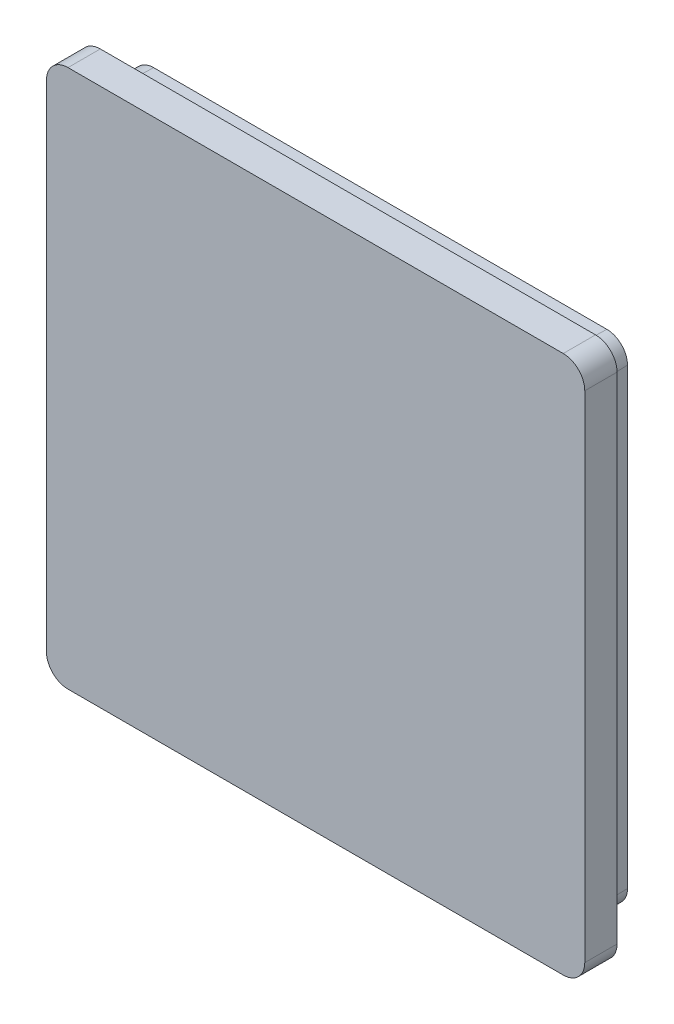
from build123d import *

# Parameters (mm, degrees)
BOSS_EXTRUDE1_DEPTH = 3
BOSS_EXTRUDE2_DEPTH = 3
BOSS_EXTRUDE2_TAPER = 1.5


with BuildPart() as part:
    # Sketch1 → Boss-Extrude1 (new body)
    with BuildSketch(Plane(origin=(0, 0, 0), x_dir=(0, 1, 0), z_dir=(0, 0, 1))):
        with BuildLine():
            Line((-23, -25), (23, -25))
            ThreePointArc((23, -25), (24.414213562, -24.414213562), (25, -23))
            Line((25, -23), (25, 23))
            ThreePointArc((25, 23), (24.414213562, 24.414213562), (23, 25))
            Line((23, 25), (-23, 25))
            ThreePointArc((-23, 25), (-24.414213562, 24.414213562), (-25, 23))
            Line((-25, 23), (-25, -23))
            ThreePointArc((-25, -23), (-24.414213562, -24.414213562), (-23, -25))
        make_face()
    extrude(amount=BOSS_EXTRUDE1_DEPTH)

    # Sketch2 → Boss-Extrude2 (add)
    with BuildSketch(Plane(origin=(0, 0, 0), x_dir=(1, 0, 0), z_dir=(0, 0, -1))):
        with BuildLine():
            Line((-21.05, -23.05), (21.05, -23.05))
            ThreePointArc((21.05, -23.05), (22.464213562, -22.464213562), (23.05, -21.05))
            Line((23.05, -21.05), (23.05, 21.05))
            ThreePointArc((23.05, 21.05), (22.464213562, 22.464213562), (21.05, 23.05))
            Line((21.05, 23.05), (-21.05, 23.05))
            ThreePointArc((-21.05, 23.05), (-22.464213562, 22.464213562), (-23.05, 21.05))
            Line((-23.05, 21.05), (-23.05, -21.05))
            ThreePointArc((-23.05, -21.05), (-22.464213562, -22.464213562), (-21.05, -23.05))
        make_face()
    extrude(amount=BOSS_EXTRUDE2_DEPTH, taper=BOSS_EXTRUDE2_TAPER)


solid = part.part
